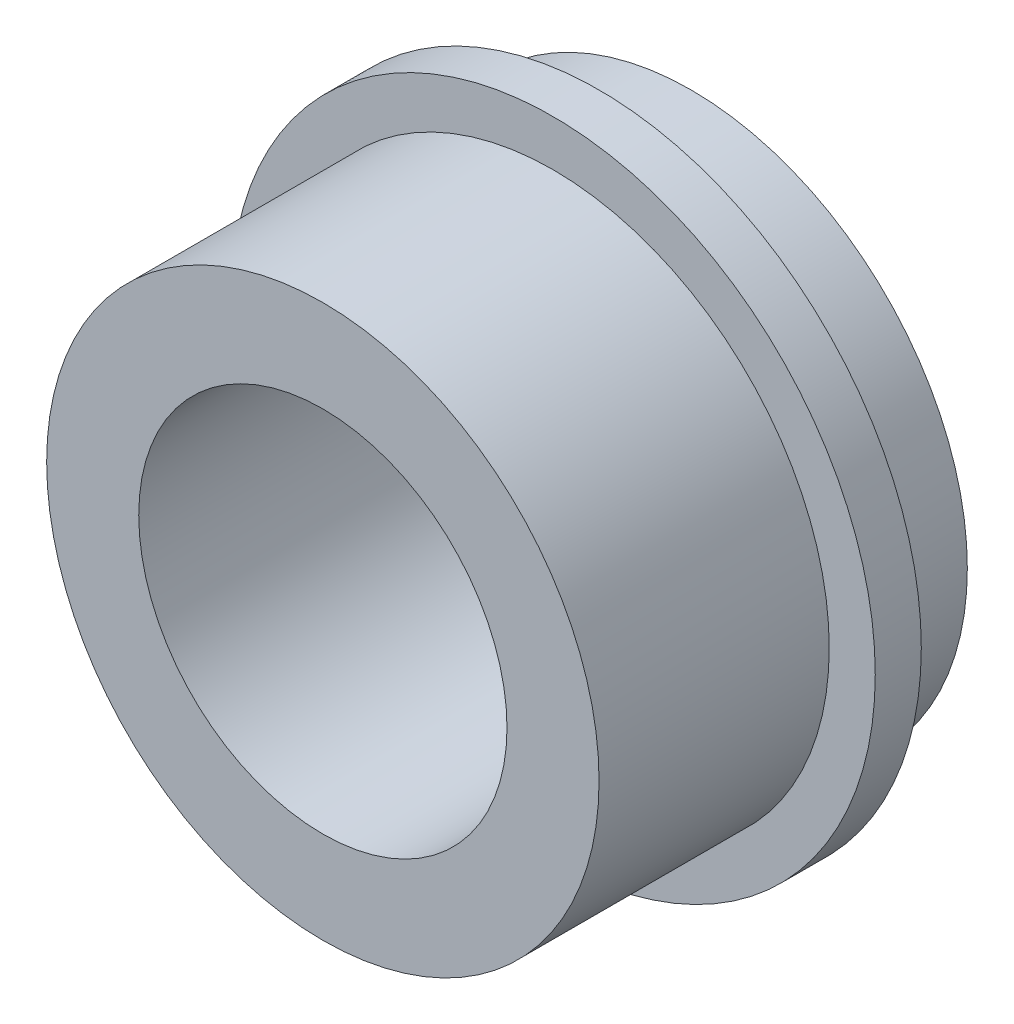
from build123d import *

# Parameters (mm, degrees)
SKETCH1_R           = 6
SKETCH1_R_2         = 4
BOSS_EXTRUDE1_DEPTH = 8
BOSS_EXTRUDE2_START = -6
SKETCH2_R           = 7
SKETCH2_R_2         = 4
BOSS_EXTRUDE2_DEPTH = 1


with BuildPart() as part:
    # Sketch1 → Boss-Extrude1 (new body)
    with BuildSketch(Plane.XY):
        Circle(SKETCH1_R)
        Circle(SKETCH1_R_2, mode=Mode.SUBTRACT)
    extrude(amount=BOSS_EXTRUDE1_DEPTH)

    # Sketch2 → Boss-Extrude2 (add)
    with BuildSketch(Plane.XY.offset(8).offset(BOSS_EXTRUDE2_START)):
        Circle(SKETCH2_R)
        Circle(SKETCH2_R_2, mode=Mode.SUBTRACT)
    extrude(amount=BOSS_EXTRUDE2_DEPTH)


solid = part.part
